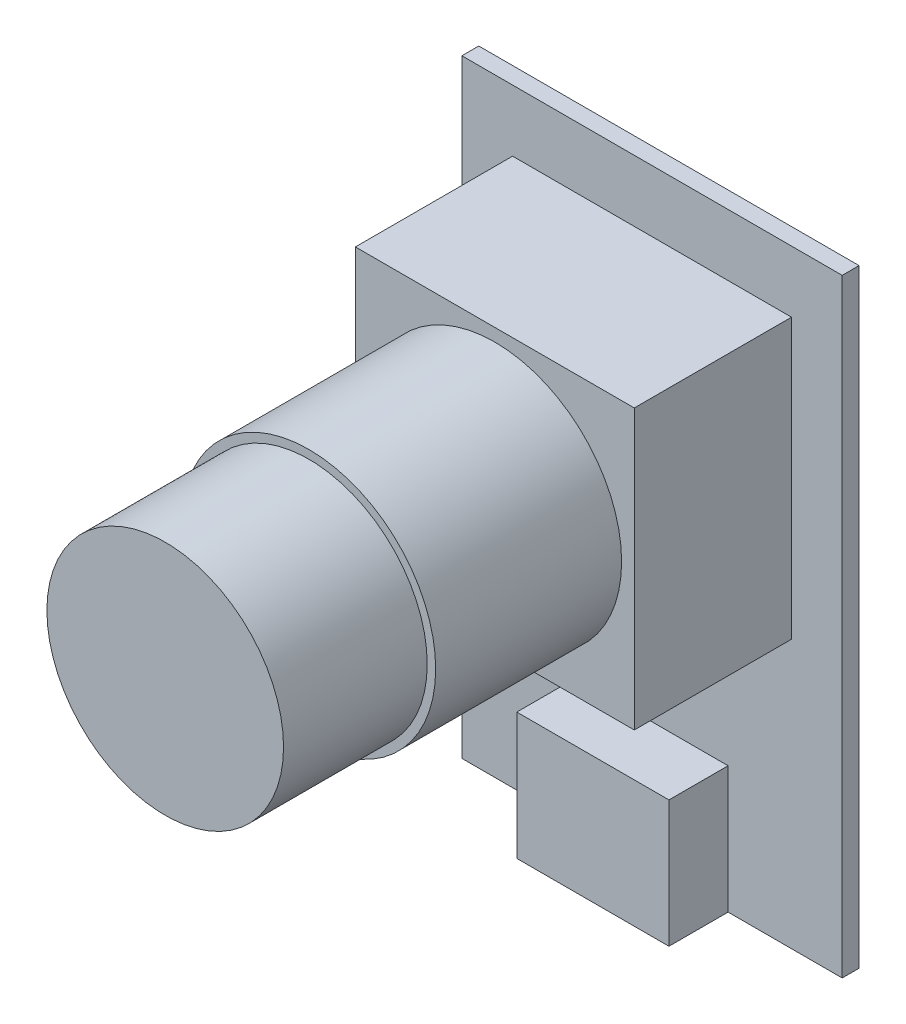
from build123d import *

# Parameters (mm, degrees)
SKETCH1_W           = 22.5
SKETCH1_H           = 36
BOSS_EXTRUDE1_DEPTH = 1
SKETCH2_W           = 16.5
SKETCH2_H           = 16.5
BOSS_EXTRUDE2_DEPTH = 9.3
SKETCH3_R           = 7.5
BOSS_EXTRUDE3_DEPTH = 11
SKETCH4_R           = 7
BOSS_EXTRUDE4_DEPTH = 8.5
SKETCH5_W           = 9
SKETCH5_H           = 7.5
BOSS_EXTRUDE5_DEPTH = 3.5
SKETCH7_W           = 11
SKETCH7_H           = 15.6
BOSS_EXTRUDE6_DEPTH = 2


with BuildPart() as part:
    # Sketch1 → Boss-Extrude1 (new body)
    with BuildSketch(Plane.XY):
        Rectangle(SKETCH1_W, SKETCH1_H)
    extrude(amount=BOSS_EXTRUDE1_DEPTH)

    # Sketch2 → Boss-Extrude2 (add)
    with BuildSketch(Plane.XY.offset(1)):
        with Locations((0, 6.106677741)):
            Rectangle(SKETCH2_W, SKETCH2_H)
    extrude(amount=BOSS_EXTRUDE2_DEPTH)

    # Sketch3 → Boss-Extrude3 (add)
    with BuildSketch(Plane.XY.offset(10.3)):
        with Locations((0, 6.106677741)):
            Circle(SKETCH3_R)
    extrude(amount=BOSS_EXTRUDE3_DEPTH)

    # Sketch4 → Boss-Extrude4 (add)
    with BuildSketch(Plane.XY.offset(21.3)):
        with Locations((0, 6.106677741)):
            Circle(SKETCH4_R)
    extrude(amount=BOSS_EXTRUDE4_DEPTH)

    # Sketch5 → Boss-Extrude5 (add)
    with BuildSketch(Plane.XY.offset(1)):
        with Locations((0, -14.25)):
            Rectangle(SKETCH5_W, SKETCH5_H)
    extrude(amount=BOSS_EXTRUDE5_DEPTH)

    # Sketch7 → Boss-Extrude6 (add)
    with BuildSketch(Plane(origin=(0, 0, 0), x_dir=(-1, 0, 0), z_dir=(0, 0, -1))):
        with Locations((0, -10.2)):
            Rectangle(SKETCH7_W, SKETCH7_H)
    extrude(amount=BOSS_EXTRUDE6_DEPTH)


solid = part.part
